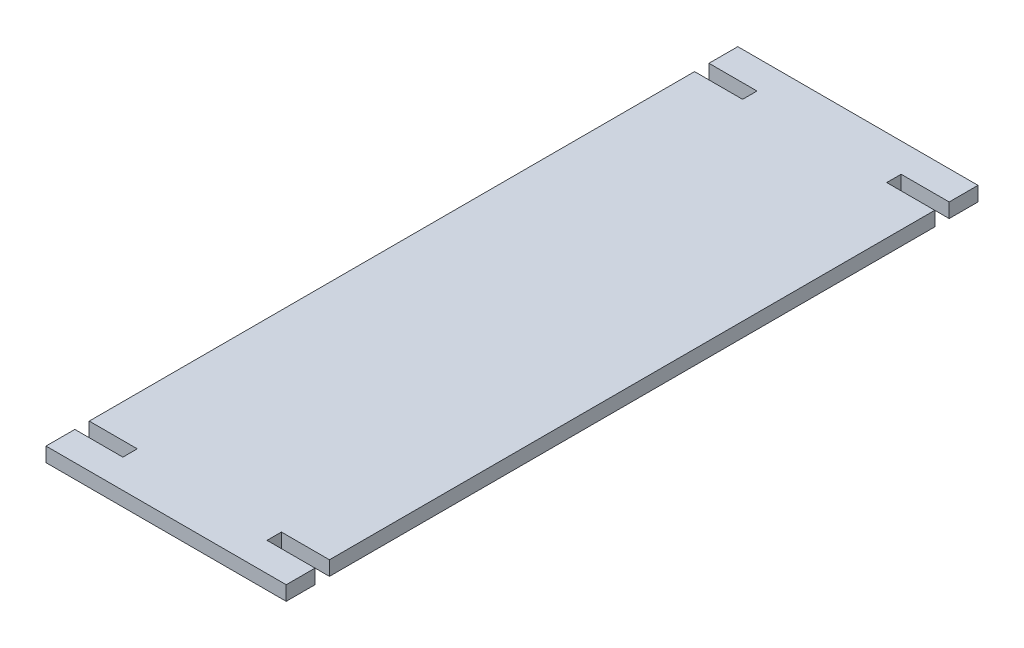
from build123d import *

# Parameters (mm, degrees)
SKETCH1_W            = 100
SKETCH1_H            = 288
BOSS_EXTRUDE1_DEPTH  = 6
SKETCH2_W            = 20
SKETCH2_H            = 6
CUT_EXTRUDE1_DEPTH   = 305.926220585
LPATTERN1_COUNT      = 2
LPATTERN1_PITCH      = 258
LPATTERN1_COUNT_DIR2 = 2
LPATTERN1_PITCH_DIR2 = 80


with BuildPart() as part:
    # Sketch1 → Boss-Extrude1 (new body)
    with BuildSketch(Plane(origin=(0, 0, 0), x_dir=(1, 0, 0), z_dir=(0, 1, 0))):
        with Locations((-50, 144)):
            Rectangle(SKETCH1_W, SKETCH1_H)
    extrude(amount=BOSS_EXTRUDE1_DEPTH)

    # Sketch2 → Cut-Extrude1 (cut, through all)
    with BuildSketch(Plane(origin=(0, 6, 0), x_dir=(1, 0, 0), z_dir=(0, 1, 0))):
        with Locations((-90, 273)):
            Rectangle(SKETCH2_W, SKETCH2_H)
    cut_extrude1 = extrude(amount=-CUT_EXTRUDE1_DEPTH, mode=Mode.SUBTRACT)

    # LPattern1: Cut-Extrude1 2 × 2
    with Locations(*[(j * LPATTERN1_PITCH_DIR2, 0, i * LPATTERN1_PITCH) for i in range(LPATTERN1_COUNT) for j in range(LPATTERN1_COUNT_DIR2) if (i, j) != (0, 0)]):
        add(cut_extrude1, mode=Mode.SUBTRACT)


solid = part.part
